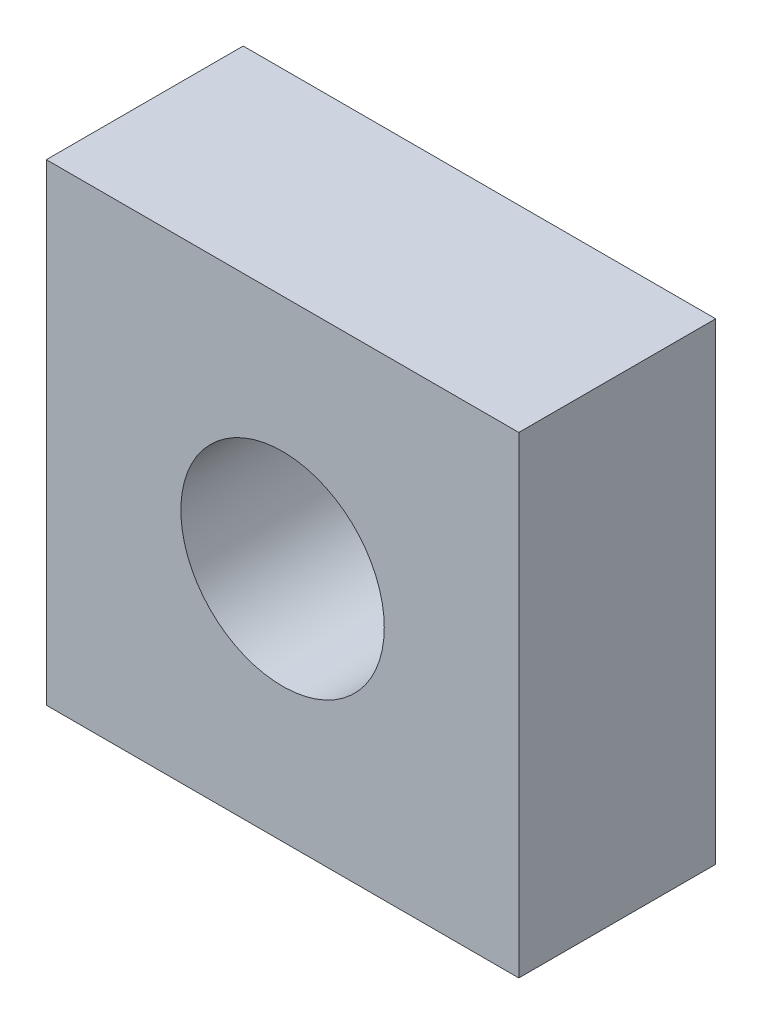
from build123d import *

# Parameters (mm, degrees)
SKETCH1_W           = 7.2
SKETCH1_H           = 7.2
BOSS_EXTRUDE1_DEPTH = 3
SKETCH2_R           = 1.55
CUT_EXTRUDE1_DEPTH  = 3


with BuildPart() as part:
    # Sketch1 → Boss-Extrude1 (new body)
    with BuildSketch(Plane.XY):
        Rectangle(SKETCH1_W, SKETCH1_H)
    extrude(amount=BOSS_EXTRUDE1_DEPTH)

    # Sketch2 → Cut-Extrude1 (cut)
    with BuildSketch(Plane.XY.offset(3)):
        Circle(SKETCH2_R)
    extrude(amount=-CUT_EXTRUDE1_DEPTH, mode=Mode.SUBTRACT)


solid = part.part
